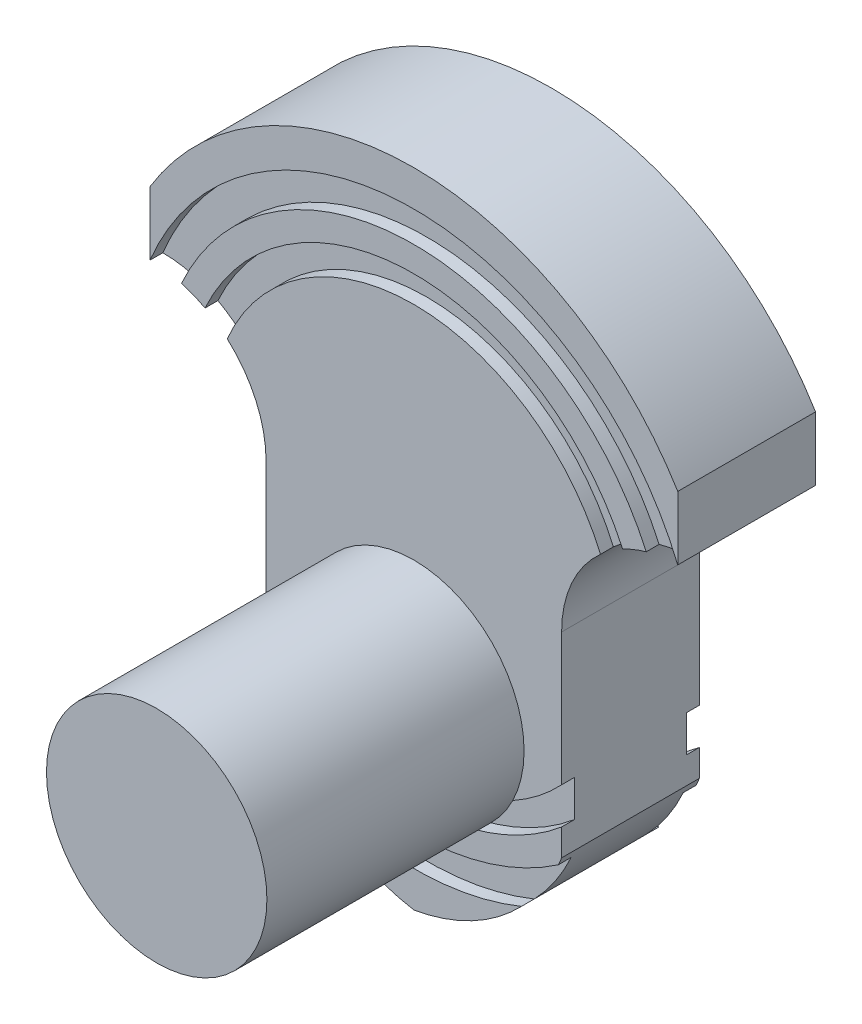
from build123d import *

# Parameters (mm, degrees)
BOSS_EXTRUDE2_DEPTH = 19.05
SKETCH3_R           = 39.496431486
SKETCH3_R_2         = 35.260007957
CUT_EXTRUDE2_DEPTH  = 1.778
SKETCH4_R           = 31.746180351
SKETCH4_R_2         = 28.068999156
CUT_EXTRUDE3_DEPTH  = 1.778
CUT_EXTRUDE4_START  = -1.778
SKETCH5_R           = 39.496431486
SKETCH5_R_2         = 35.260007957
CUT_EXTRUDE4_DEPTH  = 1.778
CUT_EXTRUDE5_START  = -1.778
SKETCH7_R           = 31.746180351
SKETCH7_R_2         = 28.068999156
CUT_EXTRUDE5_DEPTH  = 1.778
SKETCH8_R           = 15.24
BOSS_EXTRUDE3_DEPTH = 35.56


with BuildPart() as part:
    # Sketch2 → Boss-Extrude2 (new body)
    with BuildSketch(Plane.XY):
        with BuildLine():
            Line((20.429296249, -72.446914532), (20.429296249, -45.399816154))
            ThreePointArc((20.429296249, -45.399816154), (25.133677026, -34.04243628), (36.4910569, -29.338055504))
            Line((36.4910569, -29.338055504), (36.4910569, -20.532405534))
            ThreePointArc((36.4910569, -20.532405534), (20.935477727, -5.485511485), (0, 0))
            ThreePointArc((0, 0), (-20.935477727, -5.485511485), (-36.4910569, -20.532405534))
            Line((-36.4910569, -20.532405534), (-36.4910569, -29.338055504))
            ThreePointArc((-36.4910569, -29.338055504), (-25.133677026, -34.04243628), (-20.429296249, -45.399816154))
            Line((-20.429296249, -45.399816154), (-20.429296249, -72.446914532))
            ThreePointArc((-20.429296249, -72.446914532), (-12.360356233, -83.33771782), (0, -88.9))
            ThreePointArc((0, -88.9), (12.360356233, -83.33771782), (20.429296249, -72.446914532))
        make_face()
    extrude(amount=BOSS_EXTRUDE2_DEPTH)

    # Sketch3 → Cut-Extrude2 (cut)
    with BuildSketch(Plane.XY.offset(19.05)):
        with Locations((0, -44.45)):
            Circle(SKETCH3_R)
        with Locations((0, -44.45)):
            Circle(SKETCH3_R_2, mode=Mode.SUBTRACT)
    extrude(amount=-CUT_EXTRUDE2_DEPTH, mode=Mode.SUBTRACT)

    # Sketch4 → Cut-Extrude3 (cut)
    with BuildSketch(Plane.XY.offset(19.05)):
        with Locations((0, -44.45)):
            Circle(SKETCH4_R)
        with Locations((0, -44.45)):
            Circle(SKETCH4_R_2, mode=Mode.SUBTRACT)
    extrude(amount=-CUT_EXTRUDE3_DEPTH, mode=Mode.SUBTRACT)

    # Sketch5 → Cut-Extrude4 (cut)
    with BuildSketch(Plane(origin=(0, 0, 0), x_dir=(-1, 0, 0), z_dir=(0, 0, -1)).offset(CUT_EXTRUDE4_START)):
        with Locations((0, -44.45)):
            Circle(SKETCH5_R)
        with Locations((0, -44.45)):
            Circle(SKETCH5_R_2, mode=Mode.SUBTRACT)
    extrude(amount=CUT_EXTRUDE4_DEPTH, mode=Mode.SUBTRACT)

    # Sketch7 → Cut-Extrude5 (cut)
    with BuildSketch(Plane(origin=(0, 0, 0), x_dir=(-1, 0, 0), z_dir=(0, 0, -1)).offset(CUT_EXTRUDE5_START)):
        with Locations((0, -44.45)):
            Circle(SKETCH7_R)
        with Locations((0, -44.45)):
            Circle(SKETCH7_R_2, mode=Mode.SUBTRACT)
    extrude(amount=CUT_EXTRUDE5_DEPTH, mode=Mode.SUBTRACT)

    # Sketch8 → Boss-Extrude3 (add)
    with BuildSketch(Plane.XY.offset(19.05)):
        with Locations(Location((0, -62.23, 0), (0, 0, 206.225395775))):
            Circle(SKETCH8_R)
    extrude(amount=BOSS_EXTRUDE3_DEPTH)


solid = part.part
